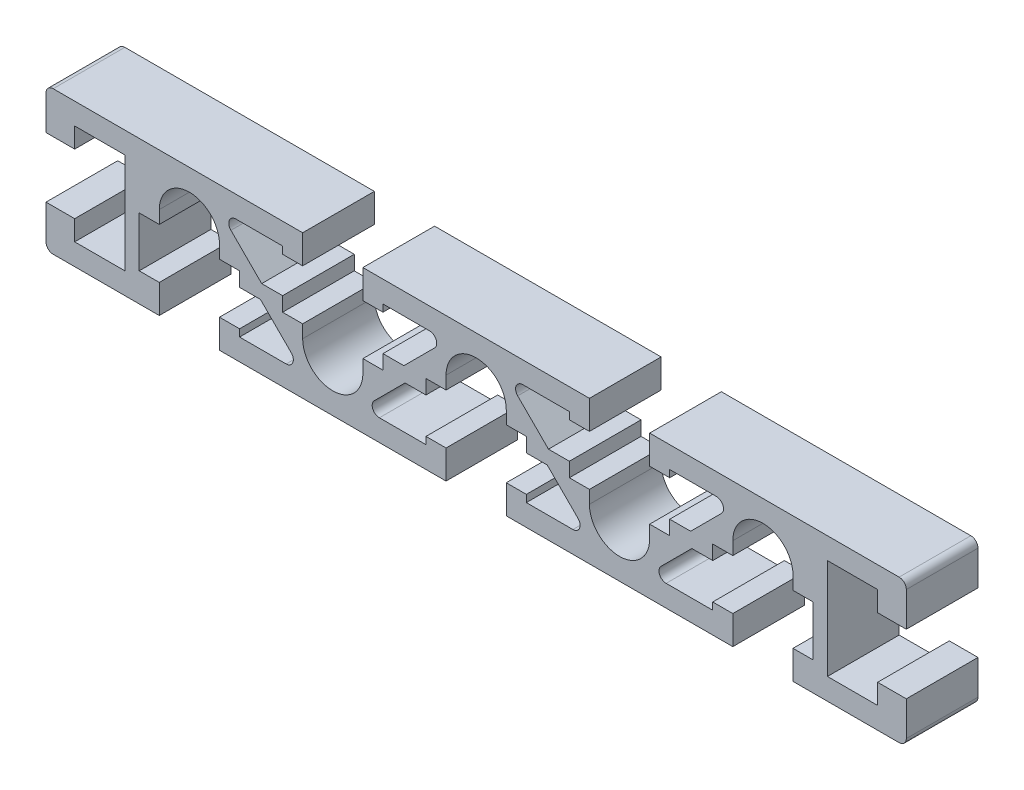
from build123d import *

# Parameters (mm, degrees)
EXTRUDE_1_DEPTH = 10


with BuildPart() as part:
    # 草图1 → 凸台-拉伸1 (new body)
    with BuildSketch(Plane.XY):
        with BuildLine():
            Line((66.531250095, 17), (73.031250095, 17))
            Line((73.031250095, 17), (73.031250095, 16))
            Line((73.031250095, 16), (75.831250095, 16))
            Line((75.831250095, 16), (75.831250095, 20))
            Line((75.831250095, 20), (60.031250095, 20))
            Line((60.031250095, 20), (44.231250095, 20))
            Line((44.231250095, 20), (44.231250095, 16))
            Line((44.231250095, 16), (47.031250095, 16))
            Line((47.031250095, 16), (47.031250095, 17))
            Line((47.031250095, 17), (53.531250095, 17))
            ThreePointArc((53.531250095, 17), (54.455129627, 16.382683432), (54.238356876, 15.292893219))
            Line((54.238356876, 15.292893219), (49.945463657, 11))
            Line((49.945463657, 11), (47.031250095, 11))
            Line((47.031250095, 11), (47.031250095, 9))
            Line((47.031250095, 9), (44.231250095, 9))
            Line((44.231250095, 9), (44.231250095, 7.2))
            ThreePointArc((44.231250095, 7.2), (40.031250095, 3), (35.831250095, 7.2))
            Line((35.831250095, 7.2), (35.831250095, 9))
            Line((35.831250095, 9), (33.031250095, 9))
            Line((33.031250095, 9), (33.031250095, 11))
            Line((33.031250095, 11), (30.117036532, 11))
            Line((30.117036532, 11), (25.824143314, 15.292893219))
            ThreePointArc((25.824143314, 15.292893219), (25.607370562, 16.382683432), (26.531250095, 17))
            Line((26.531250095, 17), (33.031250095, 17))
            Line((33.031250095, 17), (33.031250095, 16))
            Line((33.031250095, 16), (35.831250095, 16))
            Line((35.831250095, 16), (35.831250095, 20))
            Line((35.831250095, 20), (1.031250095, 20))
            ThreePointArc((1.031250095, 20), (0.324143314, 19.707106781), (0.031250095, 19))
            Line((0.031250095, 19), (0.031250095, 14.2))
            Line((0.031250095, 14.2), (4.031250095, 14.2))
            Line((4.031250095, 14.2), (4.031250095, 17))
            Line((4.031250095, 17), (11.031250095, 17))
            Line((11.031250095, 17), (11.031250095, 3))
            Line((11.031250095, 3), (4.031250095, 3))
            Line((4.031250095, 3), (4.031250095, 5.8))
            Line((4.031250095, 5.8), (0.031250095, 5.8))
            Line((0.031250095, 5.8), (0.031250095, 1))
            ThreePointArc((0.031250095, 1), (0.324143314, 0.292893219), (1.031250095, 0))
            Line((1.031250095, 0), (15.831250095, 0))
            Line((15.831250095, 0), (15.831250095, 4))
            Line((15.831250095, 4), (13.031250095, 4))
            Line((13.031250095, 4), (13.031250095, 11))
            Line((13.031250095, 11), (15.831250095, 11))
            Line((15.831250095, 11), (15.831250095, 12.8))
            ThreePointArc((15.831250095, 12.8), (20.031250095, 17), (24.231250095, 12.8))
            Line((24.231250095, 12.8), (24.231250095, 11))
            Line((24.231250095, 11), (27.031250095, 11))
            Line((27.031250095, 11), (27.031250095, 9))
            Line((27.031250095, 9), (29.945463657, 9))
            Line((29.945463657, 9), (34.238356876, 4.707106781))
            ThreePointArc((34.238356876, 4.707106781), (34.455129627, 3.617316568), (33.531250095, 3))
            Line((33.531250095, 3), (27.031250095, 3))
            Line((27.031250095, 3), (27.031250095, 4))
            Line((27.031250095, 4), (24.231250095, 4))
            Line((24.231250095, 4), (24.231250095, 0))
            Line((24.231250095, 0), (55.831250095, 0))
            Line((55.831250095, 0), (55.831250095, 4))
            Line((55.831250095, 4), (53.031250095, 4))
            Line((53.031250095, 4), (53.031250095, 3))
            Line((53.031250095, 3), (46.531250095, 3))
            ThreePointArc((46.531250095, 3), (45.607370562, 3.617316568), (45.824143314, 4.707106781))
            Line((45.824143314, 4.707106781), (50.117036532, 9))
            Line((50.117036532, 9), (53.031250095, 9))
            Line((53.031250095, 9), (53.031250095, 11))
            Line((53.031250095, 11), (55.831250095, 11))
            Line((55.831250095, 11), (55.831250095, 12.8))
            ThreePointArc((55.831250095, 12.8), (57.061401614, 15.769848481), (60.031250095, 17))
            ThreePointArc((60.031250095, 17), (63.001098576, 15.769848481), (64.231250095, 12.8))
            Line((64.231250095, 12.8), (64.231250095, 11))
            Line((64.231250095, 11), (67.031250095, 11))
            Line((67.031250095, 11), (67.031250095, 9))
            Line((67.031250095, 9), (69.945463657, 9))
            Line((69.945463657, 9), (74.238356876, 4.707106781))
            ThreePointArc((74.238356876, 4.707106781), (74.455129627, 3.617316568), (73.531250095, 3))
            Line((73.531250095, 3), (67.031250095, 3))
            Line((67.031250095, 3), (67.031250095, 4))
            Line((67.031250095, 4), (64.231250095, 4))
            Line((64.231250095, 4), (64.231250095, 0))
            Line((64.231250095, 0), (95.831250095, 0))
            Line((95.831250095, 0), (95.831250095, 4))
            Line((95.831250095, 4), (93.031250095, 4))
            Line((93.031250095, 4), (93.031250095, 3))
            Line((93.031250095, 3), (86.531250095, 3))
            ThreePointArc((86.531250095, 3), (85.607370562, 3.617316568), (85.824143314, 4.707106781))
            Line((85.824143314, 4.707106781), (90.117036532, 9))
            Line((90.117036532, 9), (93.031250095, 9))
            Line((93.031250095, 9), (93.031250095, 11))
            Line((93.031250095, 11), (95.831250095, 11))
            Line((95.831250095, 11), (95.831250095, 12.8))
            ThreePointArc((95.831250095, 12.8), (100.031250095, 17), (104.231250095, 12.8))
            Line((104.231250095, 12.8), (104.231250095, 11))
            Line((104.231250095, 11), (107.031250095, 11))
            Line((107.031250095, 11), (107.031250095, 4))
            Line((107.031250095, 4), (104.231250095, 4))
            Line((104.231250095, 4), (104.231250095, 0))
            Line((104.231250095, 0), (119.031250095, 0))
            ThreePointArc((119.031250095, 0), (119.738356876, 0.292893219), (120.031250095, 1))
            Line((120.031250095, 1), (120.031250095, 5.8))
            Line((120.031250095, 5.8), (116.031250095, 5.8))
            Line((116.031250095, 5.8), (116.031250095, 3))
            Line((116.031250095, 3), (109.031250095, 3))
            Line((109.031250095, 3), (109.031250095, 17))
            Line((109.031250095, 17), (116.031250095, 17))
            Line((116.031250095, 17), (116.031250095, 14.2))
            Line((116.031250095, 14.2), (120.031250095, 14.2))
            Line((120.031250095, 14.2), (120.031250095, 19))
            ThreePointArc((120.031250095, 19), (119.738356876, 19.707106781), (119.031250095, 20))
            Line((119.031250095, 20), (84.231250095, 20))
            Line((84.231250095, 20), (84.231250095, 16))
            Line((84.231250095, 16), (87.031250095, 16))
            Line((87.031250095, 16), (87.031250095, 17))
            Line((87.031250095, 17), (93.531250095, 17))
            ThreePointArc((93.531250095, 17), (94.455129627, 16.382683432), (94.238356876, 15.292893219))
            Line((94.238356876, 15.292893219), (89.945463657, 11))
            Line((89.945463657, 11), (87.031250095, 11))
            Line((87.031250095, 11), (87.031250095, 9))
            Line((87.031250095, 9), (84.231250095, 9))
            Line((84.231250095, 9), (84.231250095, 7.2))
            ThreePointArc((84.231250095, 7.2), (80.031250095, 3), (75.831250095, 7.2))
            Line((75.831250095, 7.2), (75.831250095, 9))
            Line((75.831250095, 9), (73.031250095, 9))
            Line((73.031250095, 9), (73.031250095, 11))
            Line((73.031250095, 11), (70.117036532, 11))
            Line((70.117036532, 11), (65.824143314, 15.292893219))
            ThreePointArc((65.824143314, 15.292893219), (65.607370562, 16.382683432), (66.531250095, 17))
        make_face()
    extrude(amount=EXTRUDE_1_DEPTH)


solid = part.part
